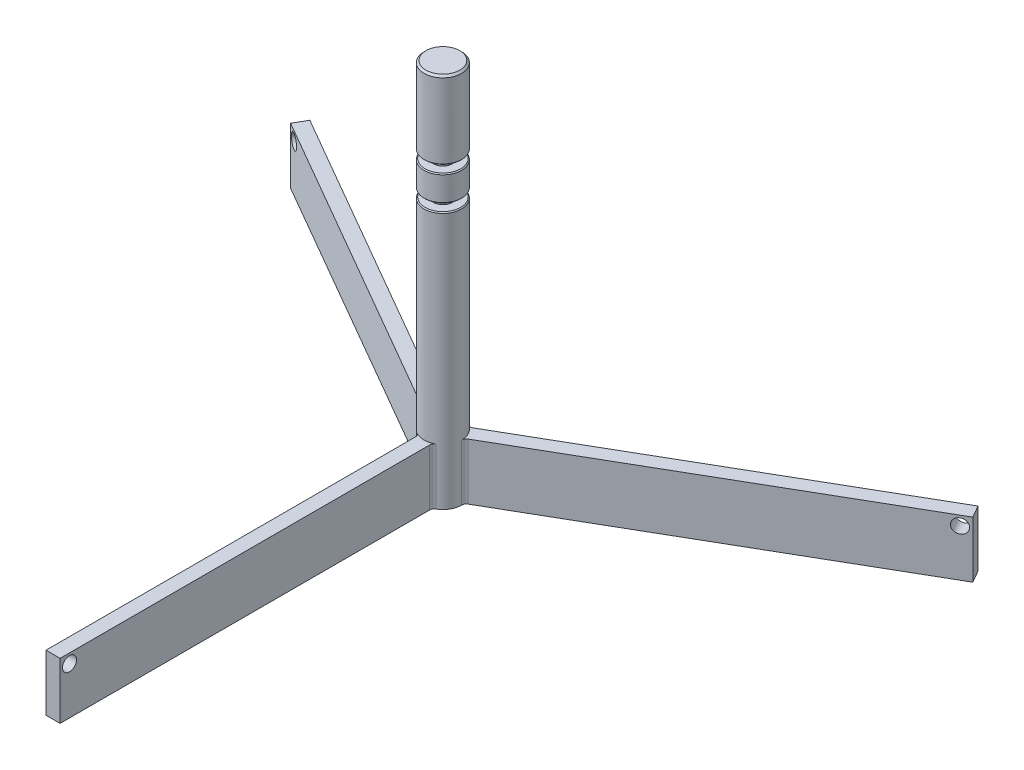
from build123d import *

# Parameters (mm, degrees)
SKETCH6_W                = 9.525
SKETCH6_H                = 38.1
BOSS_EXTRUDE2_DEPTH      = 263.525
SKETCH7_R                = 4.7625
CUT_EXTRUDE2_DEPTH       = 367.423749955
FILLET2_R                = 3.175
CIRPATTERN2_COUNT        = 3
FILLET2_OF_CIRPATTERN2_R = 3.175
CHAMFER5_SIZE            = 0.635
CHAMFER6_SIZE            = 1.27


with BuildPart() as part:
    # Sketch5 → Base-Revolve (revolve)
    with BuildSketch(Plane.XY, mode=Mode.PRIVATE) as base_revolve_sk:
        Polygon((12.7, 173.99), (6.35, 173.99), (6.35, 179.07), (12.7, 179.07), (12.7, 196.596), (6.35, 196.596), (6.35, 201.676), (12.7, 201.676), (12.7, 254), (0, 254), (0, 0), (12.7, 0), align=None)
    revolve(base_revolve_sk.sketch.rotate(Axis((0, 112.385522388, 0), (0, -1, 0)), 90), axis=Axis((0, 112.385522388, 0), (0, -1, 0)))

    # Sketch6 → Boss-Extrude2 (add)
    with BuildSketch(Plane.XY):
        with Locations((0, 19.05)):
            Rectangle(SKETCH6_W, SKETCH6_H)
    boss_extrude2 = extrude(amount=BOSS_EXTRUDE2_DEPTH)

    # Sketch7 → Cut-Extrude2 (cut, through all)
    with BuildSketch(Plane(origin=(4.7625, 0, 0), x_dir=(0, 0, -1), z_dir=(1, 0, 0))):
        with Locations(Location((-257.175, 31.75, 0), (0, 0, 90))):
            Circle(SKETCH7_R)
    cut_extrude2 = extrude(amount=-CUT_EXTRUDE2_DEPTH, mode=Mode.SUBTRACT)

    # Fillet2
    fillet2_edges = [part.edges().sort_by_distance(p)[0] for p in [
        (-4.7625, 19.05, 11.773215098),
        (4.7625, 19.05, 11.773215098),
    ]]
    fillet(fillet2_edges, radius=FILLET2_R)

    # CirPattern2: Boss-Extrude2, Cut-Extrude2 ×3 about axis
    cirpattern2_axis = Axis((0, 0, 0), (0, 1, 0))
    add([boss_extrude2.rotate(cirpattern2_axis, i * 360 / CIRPATTERN2_COUNT) for i in range(1, CIRPATTERN2_COUNT)])
    add([cut_extrude2.rotate(cirpattern2_axis, i * 360 / CIRPATTERN2_COUNT) for i in range(1, CIRPATTERN2_COUNT)], mode=Mode.SUBTRACT)

    # Fillet2 of CirPattern2
    fillet2_of_cirpattern2_edges = [part.edges().sort_by_distance(p)[0] for p in [
        (12.577153359, 19.05, -1.762161564),
        (7.814653359, 19.05, -10.011053535),
        (-7.814653359, 19.05, -10.011053535),
        (-12.577153359, 19.05, -1.762161564),
    ]]
    fillet(fillet2_of_cirpattern2_edges, radius=FILLET2_OF_CIRPATTERN2_R)

    # Chamfer5
    chamfer5_edges = [part.edges().sort_by_distance(p)[0] for p in [
        (0, 179.07, -12.7),
        (0, 196.596, -12.7),
        (0, 201.676, -12.7),
        (0, 173.99, -12.7),
    ]]
    chamfer(chamfer5_edges, length=CHAMFER5_SIZE)

    # Chamfer6
    chamfer6_edges = [part.edges().sort_by_distance(p)[0] for p in [
        (0, 254, -12.7),
    ]]
    chamfer(chamfer6_edges, length=CHAMFER6_SIZE)


solid = part.part
